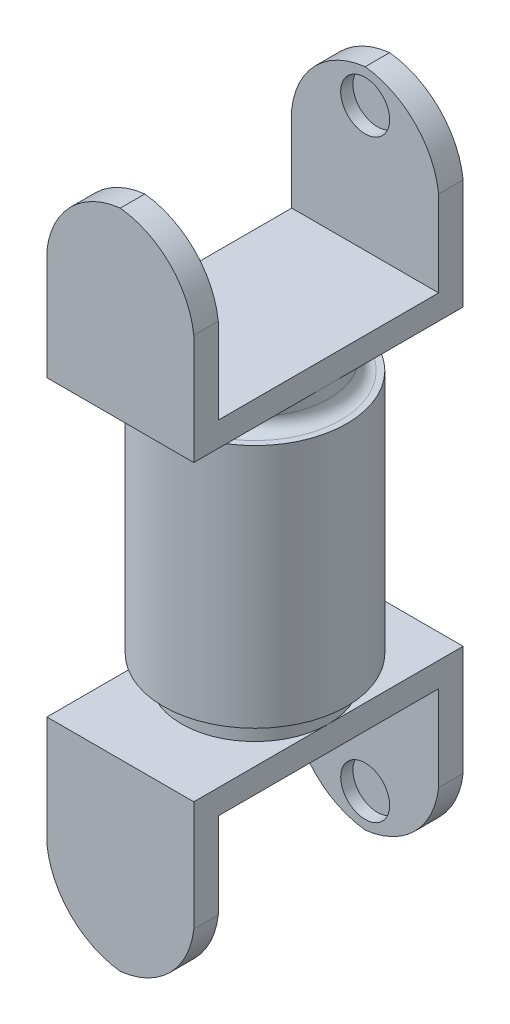
from build123d import *

# Parameters (mm, degrees)
SKETCH1_R           = 7.5
BOSS_EXTRUDE1_DEPTH = 10
SKETCH5_R           = 6
BOSS_EXTRUDE2_DEPTH = 2
FILLET2_R           = 1
BOSS_EXTRUDE3_DEPTH = 6
CUT_EXTRUDE4_DEPTH  = 29
CUT_EXTRUDE5_START  = -1
SKETCH10_R          = 2
CUT_EXTRUDE5_DEPTH  = 20


with BuildPart() as part:
    # Sketch1 → Boss-Extrude1 (new body)
    with BuildSketch(Plane(origin=(0, 0, 0), x_dir=(1, 0, 0), z_dir=(0, 1, 0))):
        Circle(SKETCH1_R)
    boss_extrude1 = extrude(amount=BOSS_EXTRUDE1_DEPTH)

    # Sketch5 → Boss-Extrude2 (add)
    with BuildSketch(Plane(origin=(0, 10, 0), x_dir=(1, 0, 0), z_dir=(0, 1, 0))):
        Circle(SKETCH5_R)
    boss_extrude2 = extrude(amount=BOSS_EXTRUDE2_DEPTH)

    # Fillet2
    fillet2_edges = [part.edges().sort_by_distance(p)[0] for p in [
        (-6, 10, 0),
    ]]
    fillet(fillet2_edges, radius=FILLET2_R)

    # Sketch6 → Boss-Extrude3 (add, symmetric)
    with BuildSketch(Plane(origin=(0, 0, 0), x_dir=(0, 0, -1), z_dir=(1, 0, 0))):
        Polygon((6, 12), (-6, 12), (-11, 12), (-11, 27), (-9, 27), (-9, 14), (9, 14), (9, 27), (11, 27), (11, 12), align=None)
    boss_extrude3 = extrude(amount=BOSS_EXTRUDE3_DEPTH, both=True)

    # Sketch9 → Cut-Extrude4 (cut)
    with BuildSketch(Plane.XY.offset(11)):
        with BuildLine():
            Line((-6, 27), (-6, 21))
            ThreePointArc((-6, 21), (-4.052343178, 25.052343178), (0, 27))
            Line((0, 27), (-6, 27))
        make_face()
        with BuildLine():
            ThreePointArc((0, 27), (4.052343178, 25.052343178), (6, 21))
            Line((6, 21), (6, 27))
            Line((6, 27), (0, 27))
        make_face()
    cut_extrude4 = extrude(amount=-CUT_EXTRUDE4_DEPTH, mode=Mode.SUBTRACT)

    # Sketch10 → Cut-Extrude5 (cut)
    with BuildSketch(Plane(origin=(0, 0, 9), x_dir=(-1, 0, 0), z_dir=(0, 0, -1)).offset(CUT_EXTRUDE5_START)):
        with Locations((0, 24.25)):
            Circle(SKETCH10_R)
    cut_extrude5 = extrude(amount=CUT_EXTRUDE5_DEPTH, mode=Mode.SUBTRACT)

    # Mirror2: Boss-Extrude1 across plane
    add(boss_extrude1.mirror(Plane.ZX))

    # Mirror9: Boss-Extrude2, Boss-Extrude3 across plane
    add(boss_extrude2.mirror(Plane.ZX))
    add(boss_extrude3.mirror(Plane.ZX))

    # Mirror11: Cut-Extrude4, Cut-Extrude5 across plane
    add(cut_extrude4.mirror(Plane.ZX), mode=Mode.SUBTRACT)
    add(cut_extrude5.mirror(Plane.ZX), mode=Mode.SUBTRACT)


solid = part.part
